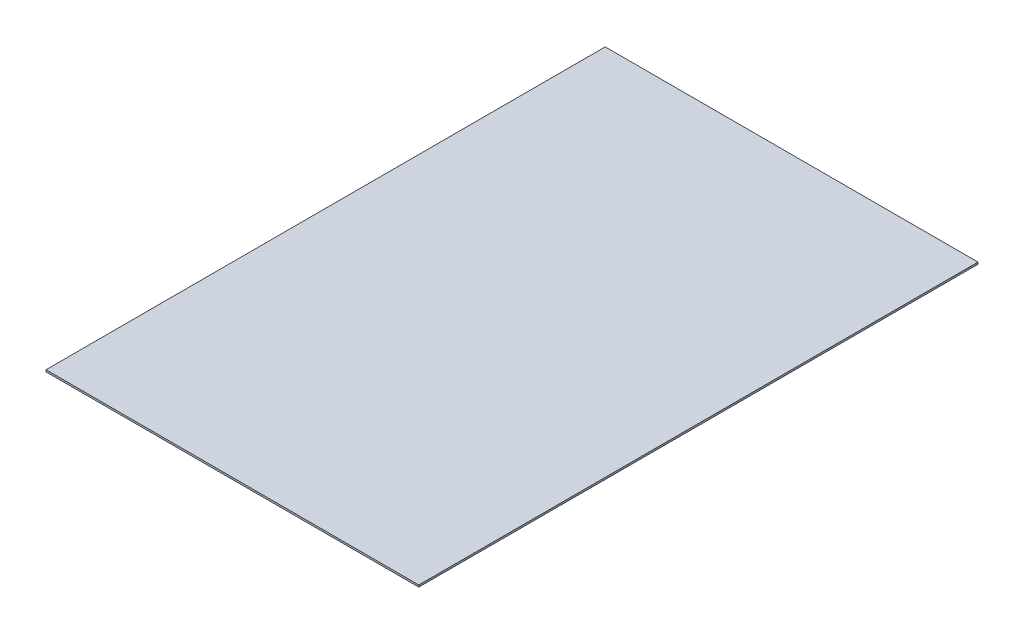
from build123d import *

# Parameters (mm, degrees)
SKETCH1_W           = 200
SKETCH1_H           = 300
BOSS_EXTRUDE1_DEPTH = 1


with BuildPart() as part:
    # Sketch1 → Boss-Extrude1 (new body)
    with BuildSketch(Plane(origin=(0, 0, 0), x_dir=(1, 0, 0), z_dir=(0, 1, 0))):
        Rectangle(SKETCH1_W, SKETCH1_H)
    extrude(amount=BOSS_EXTRUDE1_DEPTH)


solid = part.part
